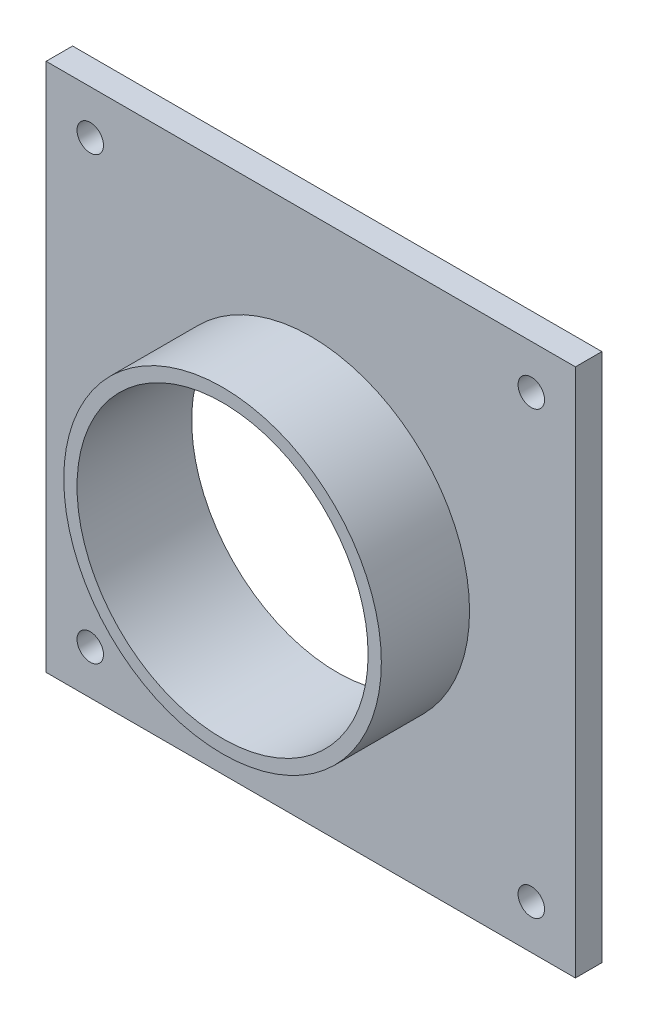
from build123d import *

# Parameters (mm, degrees)
SKETCH1_W           = 60
SKETCH1_H           = 60
SKETCH1_R           = 16.5
SKETCH1_R_2         = 1.5
BOSS_EXTRUDE1_DEPTH = 3
SKETCH2_R           = 18
SKETCH2_R_2         = 16.5
BOSS_EXTRUDE2_DEPTH = 10


with BuildPart() as part:
    # Sketch1 → Boss-Extrude1 (new body)
    with BuildSketch(Plane.XY):
        with Locations((30, 30)):
            Rectangle(SKETCH1_W, SKETCH1_H)
        with Locations((30, 30)):
            Circle(SKETCH1_R, mode=Mode.SUBTRACT)
        with Locations((5, 55)):
            Circle(SKETCH1_R_2, mode=Mode.SUBTRACT)
        with Locations(Location((55, 55, 0), (0, 0, 180))):
            Circle(SKETCH1_R_2, mode=Mode.SUBTRACT)
        with Locations((55, 5)):
            Circle(SKETCH1_R_2, mode=Mode.SUBTRACT)
        with Locations(Location((5, 5, 0), (0, 0, 180))):
            Circle(SKETCH1_R_2, mode=Mode.SUBTRACT)
    extrude(amount=BOSS_EXTRUDE1_DEPTH)

    # Sketch2 → Boss-Extrude2 (add)
    with BuildSketch(Plane.XY.offset(3)):
        with Locations((30, 30)):
            Circle(SKETCH2_R)
        with Locations((30, 30)):
            Circle(SKETCH2_R_2, mode=Mode.SUBTRACT)
    extrude(amount=BOSS_EXTRUDE2_DEPTH)


solid = part.part
